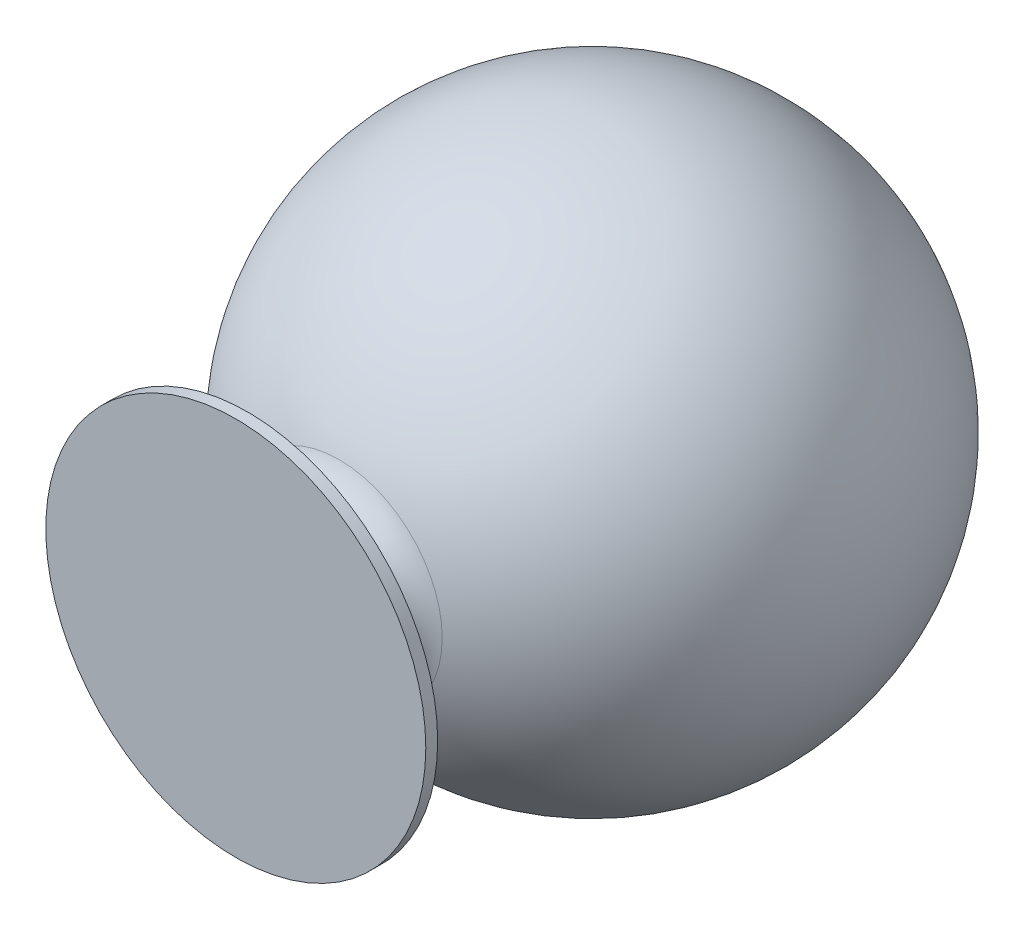
from build123d import *


with BuildPart() as part:
    # Sketch2 → Revolve4 (revolve)
    with BuildSketch(Plane(origin=(0, 0, 0), x_dir=(1, 0, 0), z_dir=(0, 1, 0)), mode=Mode.PRIVATE) as revolve4_sk:
        with BuildLine():
            Line((-16, -30), (-16, -29))
            ThreePointArc((-16, -29), (-12.409377113, -28.714795113), (-8.908801937, -27.866332983))
            ThreePointArc((-8.908801937, -27.866332983), (-6.502136556, -24.663058003), (-8.679245283, -21.299546974))
            ThreePointArc((-8.679245283, -21.299546974), (-22.570883682, 4.422127293), (0, 23))
            Line((0, 23), (0, -30))
            Line((0, -30), (-16, -30))
        make_face()
    revolve(revolve4_sk.sketch.rotate(Axis((0, 0, 29.938830716), (0, 0, -1)), 180), axis=Axis((0, 0, 29.938830716), (0, 0, -1)))


solid = part.part
